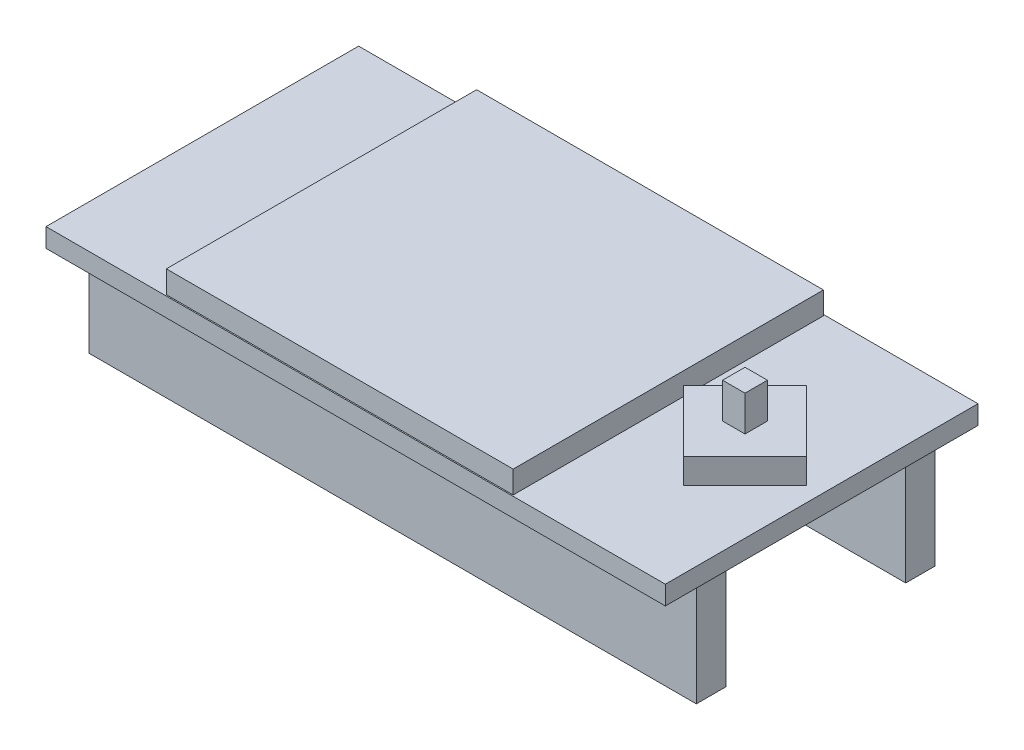
from build123d import *

# Parameters (mm, degrees)
SKETCH1_W             = 51.5
SKETCH1_H             = 2.5
BOSS_EXTRUDE1_DEPTH   = 9
BOSS_EXTRUDE1_2_DEPTH = 9
SKETCH2_W             = 52.5
SKETCH2_H             = 26.5
BOSS_EXTRUDE2_DEPTH   = 1.6
SKETCH3_W             = 29.4
SKETCH3_H             = 26.3
BOSS_EXTRUDE3_DEPTH   = 1.9
BOSS_EXTRUDE4_DEPTH   = 2.1
SKETCH5_W             = 1.9
SKETCH5_H             = 1.9
BOSS_EXTRUDE5_DEPTH   = 3


with BuildPart() as part:
    # Sketch1 → Boss-Extrude1 (new body)
    with BuildSketch(Plane(origin=(0, 0, 0), x_dir=(1, 0, 0), z_dir=(0, 1, 0))):
        with Locations((0, 8.875)):
            Rectangle(SKETCH1_W, SKETCH1_H)
    extrude(amount=BOSS_EXTRUDE1_DEPTH)



with BuildPart() as body_2:
    # Sketch1 → Boss-Extrude1 2 (new body)
    with BuildSketch(Plane(origin=(0, 0, 0), x_dir=(1, 0, 0), z_dir=(0, 1, 0))):
        with Locations((0, -8.875)):
            Rectangle(SKETCH1_W, SKETCH1_H)
    extrude(amount=BOSS_EXTRUDE1_2_DEPTH)


with BuildPart() as part_1:
    add(part.part)

    add(body_2.part)  # Boss-Extrude2 merges body 2
    # Sketch2 → Boss-Extrude2 (add)
    with BuildSketch(Plane(origin=(0, 9, 0), x_dir=(1, 0, 0), z_dir=(0, 1, 0))):
        Rectangle(SKETCH2_W, SKETCH2_H)
    extrude(amount=BOSS_EXTRUDE2_DEPTH)

    # Sketch3 → Boss-Extrude3 (add)
    with BuildSketch(Plane(origin=(0, 10.6, 0), x_dir=(1, 0, 0), z_dir=(0, 1, 0))):
        with Locations((-1.45, 0)):
            Rectangle(SKETCH3_W, SKETCH3_H)
    extrude(amount=BOSS_EXTRUDE3_DEPTH)

    # Sketch4 → Boss-Extrude4 (add)
    with BuildSketch(Plane(origin=(0, 10.6, 0), x_dir=(1, 0, 0), z_dir=(0, 1, 0))):
        Polygon((24.982590181, 0), (19.75, -5.232590181), (14.517409819, 0), (19.75, 5.232590181), align=None)
    extrude(amount=BOSS_EXTRUDE4_DEPTH)

    # Sketch5 → Boss-Extrude5 (add)
    with BuildSketch(Plane(origin=(0, 12.7, 0), x_dir=(1, 0, 0), z_dir=(0, 1, 0))):
        with Locations((19.75, 0)):
            Rectangle(SKETCH5_W, SKETCH5_H)
    extrude(amount=BOSS_EXTRUDE5_DEPTH)


solid = part_1.part
